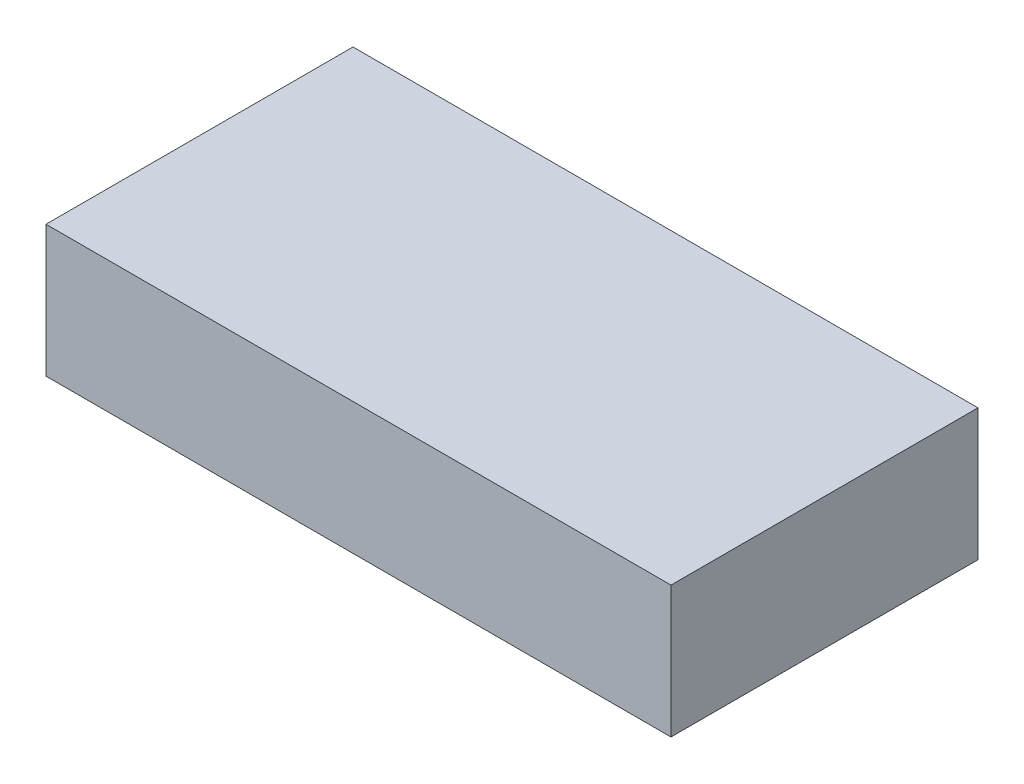
from build123d import *

# Parameters (mm, degrees)
SKETCH1_W           = 88.9
SKETCH1_H           = 38.1
BOSS_EXTRUDE1_DEPTH = 90.4875


with BuildPart() as part:
    # Sketch1 → Boss-Extrude1 (new, symmetric)
    with BuildSketch(Plane(origin=(0, 0, 0), x_dir=(0, 0, -1), z_dir=(1, 0, 0))):
        Rectangle(SKETCH1_W, SKETCH1_H)
    extrude(amount=BOSS_EXTRUDE1_DEPTH, both=True)


solid = part.part
